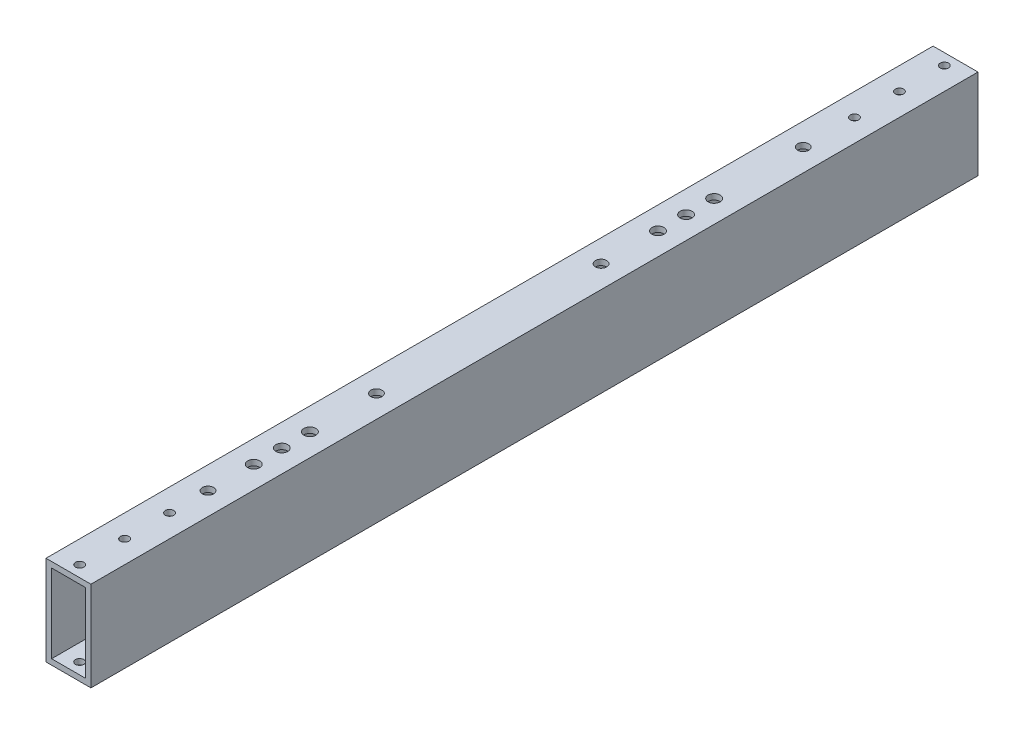
from build123d import *

# Parameters (mm, degrees)
SKETCH1_W                         = 25.4
SKETCH1_H                         = 50.8
SKETCH1_W_2                       = 19.05
SKETCH1_H_2                       = 44.45
EXTRUDE_THIN1_DEPTH               = 501.65
F_3_16_0_1875_DIAMETER_HOLE1_D    = 4.7625
F_3_16_0_195_DIAMETER_HOLE1_D     = 4.953
F_3_16_0_195_DIAMETER_HOLE1_DEPTH = 3.175
F_1_4_0_25_DIAMETER_HOLE1_D       = 6.35
F_1_4_0_25_DIAMETER_HOLE1_DEPTH   = 25.4
F_1_4_0_25_DIAMETER_HOLE1_TIP     = 1.907732465
F_1_4_CLEARANCE_HOLE1_D           = 6.7564
F_1_4_CLEARANCE_HOLE1_DEPTH       = 38.1
F_1_4_CLEARANCE_HOLE1_TIP         = 2.029827343


with BuildPart() as part:
    # Sketch1 → Extrude-Thin1 (new body)
    with BuildSketch(Plane.XY):
        Rectangle(SKETCH1_W, SKETCH1_H)
        Rectangle(SKETCH1_W_2, SKETCH1_H_2, mode=Mode.SUBTRACT)
    extrude(amount=EXTRUDE_THIN1_DEPTH)

    # 3/16 (0.1875) Diameter Hole1 (through all)
    with Locations(Plane(origin=(0, 25.4, 495.3), x_dir=(0, 0, 1), z_dir=(0, 1, 0))):
        with Locations((0, 0), (-488.95, 0), (-463.55, 0), (-438.15, 0), (-25.4, 0), (-50.8, 0)):
            Hole(F_3_16_0_1875_DIAMETER_HOLE1_D / 2)

    # 3/16 (0.195) Diameter Hole1
    with Locations(Plane(origin=(0, -25.4, 0), x_dir=(-1, 0, 0), z_dir=(0, -1, 0))):
        with Locations((-3.175, -85.719336228), (3.175, -111.119336228), (-3.175, -136.519336228), (3.175, -161.919336228), (-3.175, -187.319336228), (3.175, -212.719336228), (-3.175, -238.119336228), (3.175, -263.519336228), (-3.175, -288.919336228), (3.175, -314.319336228), (-3.175, -339.719336228), (3.175, -365.119336228), (3.175, -415.919336228), (-3.175, -390.519336228)):
            Hole(F_3_16_0_195_DIAMETER_HOLE1_D / 2, depth=F_3_16_0_195_DIAMETER_HOLE1_DEPTH)

    # 1/4 (0.25) Diameter Hole1
    with Locations(Plane(origin=(0, 25.4, 0), x_dir=(1, 0, 0), z_dir=(0, 1, 0))):
        with Locations((0, -200.464463093), (0, -422.731), (0, -327.481), (0, -86.154539829)):
            Hole(F_1_4_0_25_DIAMETER_HOLE1_D / 2, depth=F_1_4_0_25_DIAMETER_HOLE1_DEPTH)
            with Locations((0, 0, -(F_1_4_0_25_DIAMETER_HOLE1_DEPTH + F_1_4_0_25_DIAMETER_HOLE1_TIP / 2))):  # 118° drill point
                Cone(0, F_1_4_0_25_DIAMETER_HOLE1_D / 2, F_1_4_0_25_DIAMETER_HOLE1_TIP, mode=Mode.SUBTRACT)

    # 1/4 Clearance Hole1
    with Locations(Plane(origin=(-381, 25.4, 250.825), x_dir=(1, 0, 0), z_dir=(0, 1, 0))):
        with Locations((381, 82.55), (381, 98.425), (381, 114.3), (381, -146.05), (381, -130.175), (381, -114.3), (-381, -146.05), (-381, -130.175), (-381, -114.3), (-381, 82.55), (-381, 98.425), (-381, 114.3)):
            Hole(F_1_4_CLEARANCE_HOLE1_D / 2, depth=F_1_4_CLEARANCE_HOLE1_DEPTH)
            with Locations((0, 0, -(F_1_4_CLEARANCE_HOLE1_DEPTH + F_1_4_CLEARANCE_HOLE1_TIP / 2))):  # 118° drill point
                Cone(0, F_1_4_CLEARANCE_HOLE1_D / 2, F_1_4_CLEARANCE_HOLE1_TIP, mode=Mode.SUBTRACT)


solid = part.part
